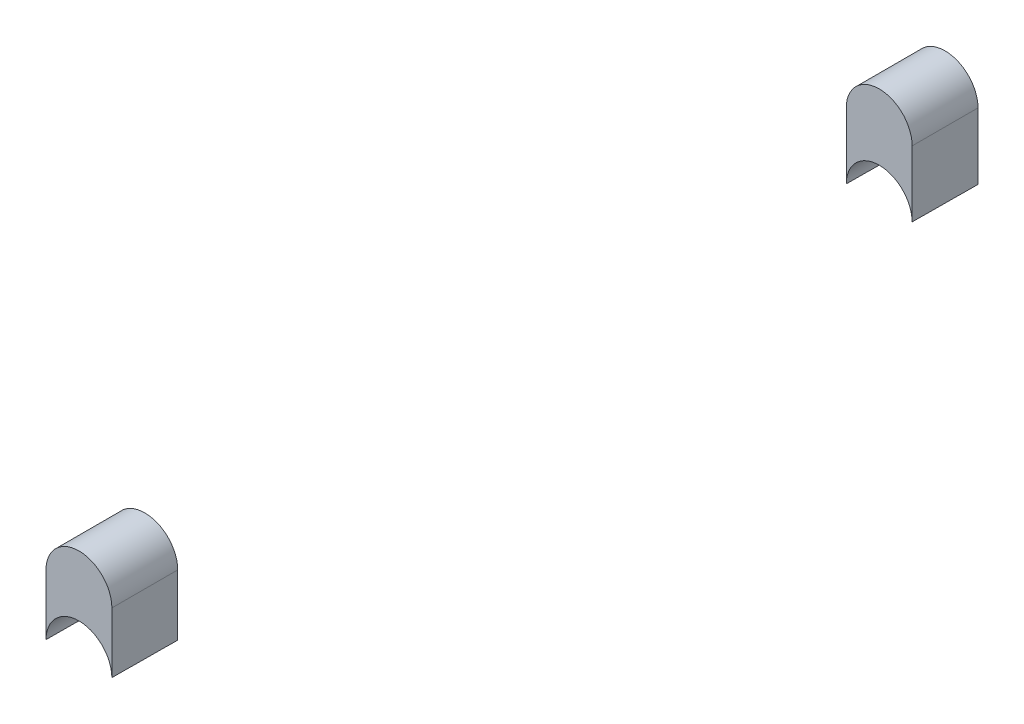
from build123d import *

# Parameters (mm, degrees)
BOSS_EXTRUDE2_DEPTH      = 65.75
BOSS_EXTRUDE2_DEPTH_BACK = 65.75
CUT_EXTRUDE1_DEPTH       = 143.629623671
CUT_EXTRUDE2_DEPTH       = 86.866539031
CUT_EXTRUDE2_DEPTH_BACK  = 86.866539031
SKETCH6_W                = 111.5
SKETCH6_H                = 20


with BuildPart() as part:
    # Sketch2 → Boss-Extrude2 (new, two sides: drawn at the far end of the back side and taken through both)
    with BuildSketch(Plane.XY.offset(-BOSS_EXTRUDE2_DEPTH_BACK)):
        with BuildLine():
            ThreePointArc((-5, -50), (0, -45), (5, -50))
            Line((5, -50), (5, 50))
            ThreePointArc((5, 50), (0, 55), (-5, 50))
            Line((-5, 50), (-5, -50))
        make_face()
    extrude(amount=BOSS_EXTRUDE2_DEPTH + BOSS_EXTRUDE2_DEPTH_BACK)

    # Sketch5 → Cut-Extrude1 (cut, through all, along a direction that is not the sketch's normal)
    with BuildSketch(Plane.XY.offset(65.75)):
        with BuildLine():
            ThreePointArc((-5, -50), (0, -45), (5, -50))
            Line((5, -50), (5, 40.834103429))
            ThreePointArc((5, 40.834103429), (0, 45.8), (-5, 40.834103429))
            Line((-5, 40.834103429), (-5, -50))
        make_face()
    extrude(amount=-CUT_EXTRUDE1_DEPTH, dir=(0, 0.00684394617439934, 0.999976579926131), mode=Mode.SUBTRACT)

    # Sketch6 → Cut-Extrude2 (cut, two sides: drawn at the far end of the back side and taken through both)
    with BuildSketch(Plane(origin=(0, 0, 0), x_dir=(0, 0, -1), z_dir=(1, 0, 0)).offset(-CUT_EXTRUDE2_DEPTH_BACK)):
        with Locations((0, 45)):
            Rectangle(SKETCH6_W, SKETCH6_H)
    extrude(amount=CUT_EXTRUDE2_DEPTH + CUT_EXTRUDE2_DEPTH_BACK, mode=Mode.SUBTRACT)


with BuildPart() as cut_extrude2_piece_1:
    # of the separate pieces the step leaves, piece 1, a body of its own (cut_extrude2_pieces)
    add(part.part.solids().sort_by_distance((-5, 50, -55.75))[0])


with BuildPart() as cut_extrude2_piece_2:
    # of the separate pieces the step leaves, piece 2, a body of its own (cut_extrude2_pieces)
    add(part.part.solids().sort_by_distance((-5, 50, 65.75))[0])


solid = Compound([cut_extrude2_piece_1.part, cut_extrude2_piece_2.part])
